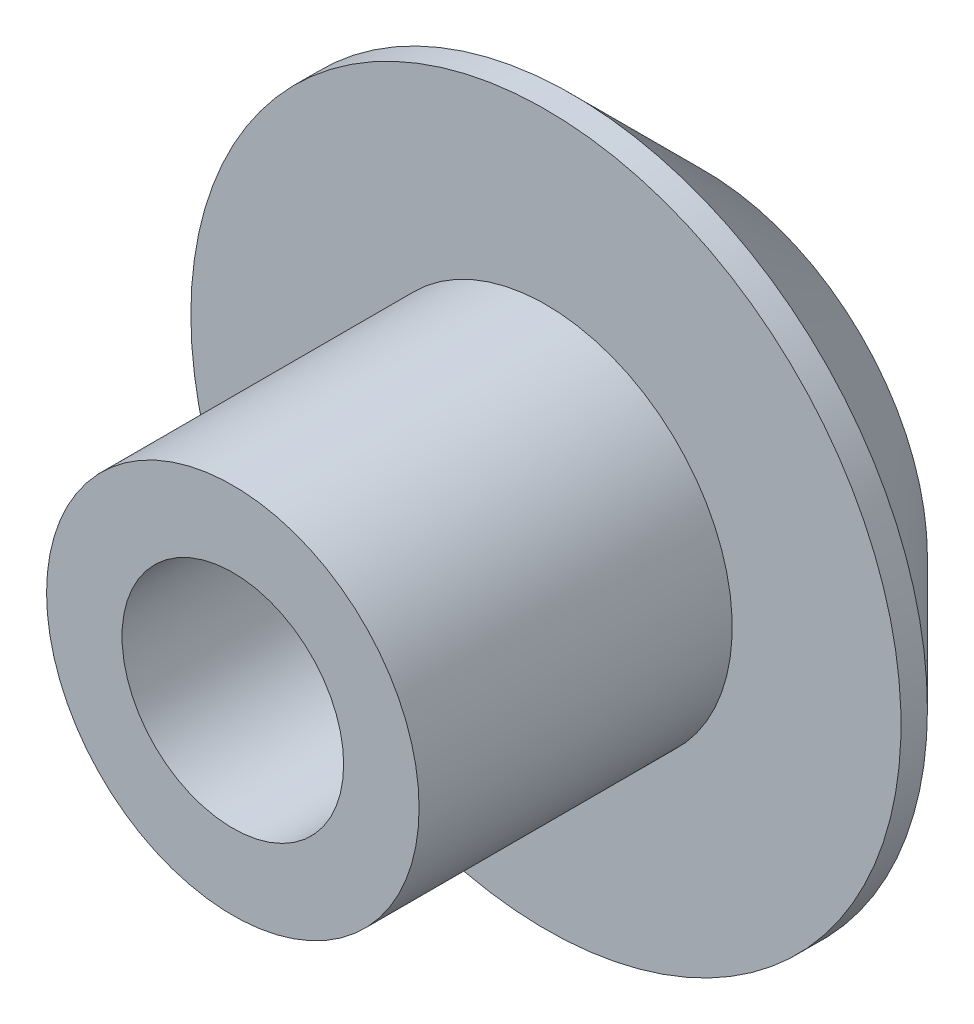
from build123d import *

# Parameters (mm, degrees)
ESBO_O1_R                = 1.975
ESBO_O1_R_2              = 1.175
RESSALTO_EXTRUS_O1_DEPTH = 5
ESBO_O2_R                = 3.765
ESBO_O2_R_2              = 1.175
RESSALTO_EXTRUS_O2_DEPTH = 1.68
CHANFRO1_SIZE            = 1.4


with BuildPart() as part:
    # Esboço1 → Ressalto-extrusão1 (new body)
    with BuildSketch(Plane.XY):
        Circle(ESBO_O1_R)
        Circle(ESBO_O1_R_2, mode=Mode.SUBTRACT)
    extrude(amount=RESSALTO_EXTRUS_O1_DEPTH)

    # Esboço2 → Ressalto-extrusão2 (add)
    with BuildSketch(Plane(origin=(0, 0, 0), x_dir=(-1, 0, 0), z_dir=(0, 0, -1))):
        Circle(ESBO_O2_R)
        with Locations(Location((0, 0, 0), (0, 0, 180))):
            Circle(ESBO_O2_R_2, mode=Mode.SUBTRACT)
    extrude(amount=-RESSALTO_EXTRUS_O2_DEPTH)

    # Chanfro1
    chanfro1_edges = [part.edges().sort_by_distance(p)[0] for p in [
        (3.765, 0, 0),
    ]]
    chamfer(chanfro1_edges, length=CHANFRO1_SIZE)


solid = part.part
